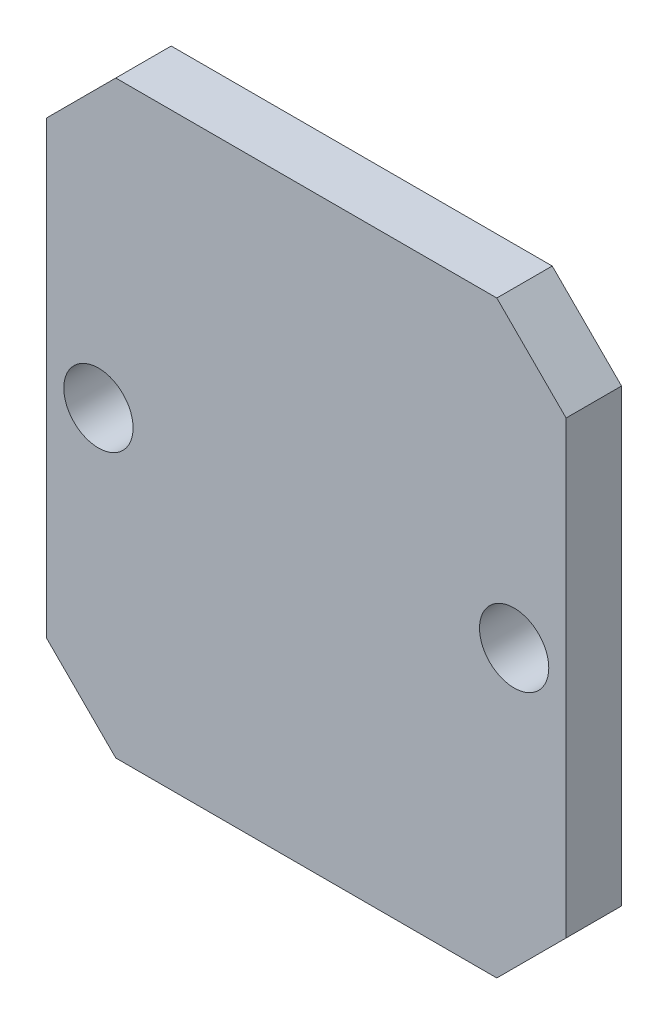
from build123d import *

# Parameters (mm, degrees)
ESBO_O1_W                = 15
ESBO_O1_H                = 17
ESBO_O1_R                = 1
RESSALTO_EXTRUS_O1_DEPTH = 1.6
CHANFRO1_SIZE            = 2


with BuildPart() as part:
    # Esboço1 → Ressalto-extrusão1 (new body)
    with BuildSketch(Plane.XY):
        with Locations((2.895389518, -3.7)):
            Rectangle(ESBO_O1_W, ESBO_O1_H)
        with Locations((8.895389518, -3.7)):
            Circle(ESBO_O1_R, mode=Mode.SUBTRACT)
        with Locations((-3.104610482, -3.7)):
            Circle(ESBO_O1_R, mode=Mode.SUBTRACT)
    extrude(amount=RESSALTO_EXTRUS_O1_DEPTH)

    # Chanfro1
    chanfro1_edges = [part.edges().sort_by_distance(p)[0] for p in [
        (-4.604610482, 4.8, 0.8),
        (10.395389518, 4.8, 0.8),
        (10.395389518, -12.2, 0.8),
        (-4.604610482, -12.2, 0.8),
    ]]
    chamfer(chanfro1_edges, length=CHANFRO1_SIZE)


solid = part.part
